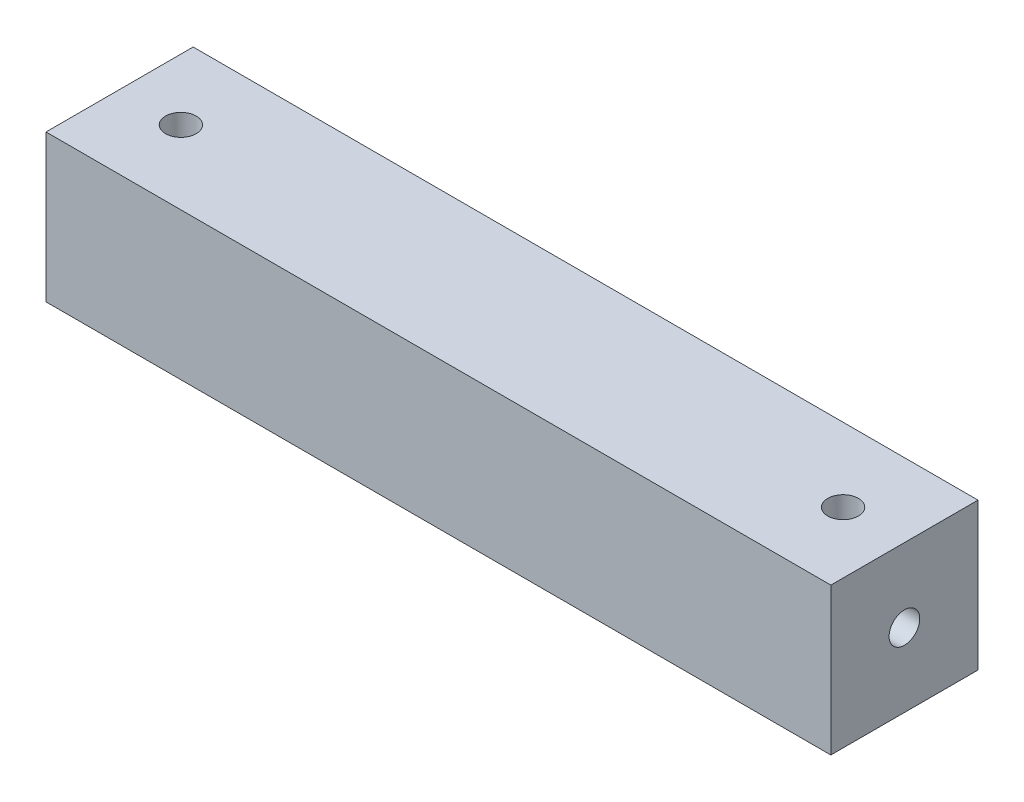
from build123d import *

# Parameters (mm, degrees)
ESQUISSE1_W             = 32
ESQUISSE1_H             = 6
BOSS_EXTRU_1_DEPTH      = 6
ESQUISSE2_R             = 0.625
ENL_V_MAT_EXTRU_1_DEPTH = 34.105890714
ESQUISSE3_R             = 0.625
ENL_V_MAT_EXTRU_2_DEPTH = 34.105890714


with BuildPart() as part:
    # Esquisse1 → Boss.-Extru.1 (new body)
    with BuildSketch(Plane.XY):
        with Locations((-16, -3)):
            Rectangle(ESQUISSE1_W, ESQUISSE1_H)
    extrude(amount=BOSS_EXTRU_1_DEPTH)

    # Esquisse2 → Enlèv. mat.-Extru.1 (cut, through all)
    with BuildSketch(Plane.ZY.offset(32)):
        with Locations((3, -3)):
            Circle(ESQUISSE2_R)
    extrude(amount=-ENL_V_MAT_EXTRU_1_DEPTH, mode=Mode.SUBTRACT)

    # Esquisse3 → Enlèv. mat.-Extru.2 (cut, through all)
    with BuildSketch(Plane.XZ.offset(6)):
        with Locations((-29.5, 3)):
            Circle(ESQUISSE3_R)
        with Locations((-2.5, 3)):
            Circle(ESQUISSE3_R)
    extrude(amount=-ENL_V_MAT_EXTRU_2_DEPTH, mode=Mode.SUBTRACT)


solid = part.part
